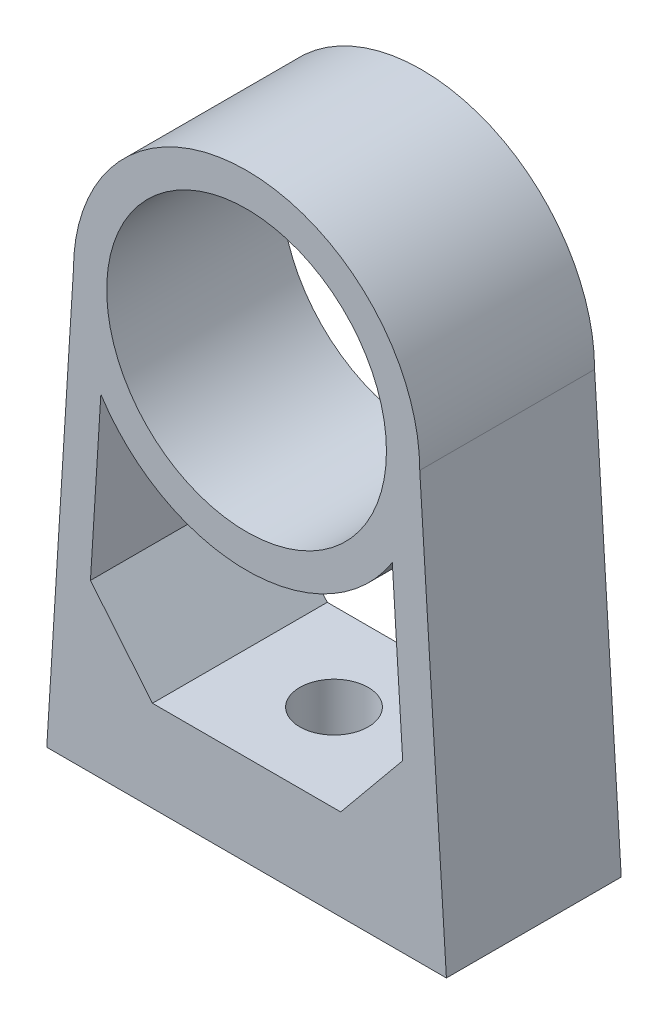
from build123d import *

# Parameters (mm, degrees)
SKETCH1_R                   = 13.335
BOSS_EXTRUDE1_DEPTH         = 16.66875
F_1_4_CLEARANCE_HOLE1_D     = 6.5278
F_1_4_CLEARANCE_HOLE1_DEPTH = 8.671275816


with BuildPart() as part:
    # Sketch1 → Boss-Extrude1 (new body)
    with BuildSketch(Plane.XY):
        with BuildLine():
            Line((-19.05, -40.64), (19.05, -40.64))
            Line((19.05, -40.64), (16.51, 0))
            ThreePointArc((16.51, 0), (0, 16.51), (-16.51, 0))
            Line((-16.51, 0), (-19.05, -40.64))
        make_face()
        Circle(SKETCH1_R, mode=Mode.SUBTRACT)
        with BuildLine():
            Line((-13.892538769, -8.920620301), (-14.883769384, -24.780310151))
            Line((-14.883769384, -24.780310151), (-8.97384088, -31.968724184))
            Line((-8.97384088, -31.968724184), (8.97384088, -31.968724184))
            Line((8.97384088, -31.968724184), (14.883769384, -24.780310151))
            Line((14.883769384, -24.780310151), (13.892538769, -8.920620301))
            ThreePointArc((13.892538769, -8.920620301), (0, -16.51), (-13.892538769, -8.920620301))
        make_face(mode=Mode.SUBTRACT)
    extrude(amount=BOSS_EXTRUDE1_DEPTH)

    # 1/4 Clearance Hole1
    with Locations(Plane(origin=(0, -40.64, 0), x_dir=(-1, 0, 0), z_dir=(0, -1, 0))):
        with Locations((0, -8.334375)):
            Hole(F_1_4_CLEARANCE_HOLE1_D / 2, depth=F_1_4_CLEARANCE_HOLE1_DEPTH)


solid = part.part
